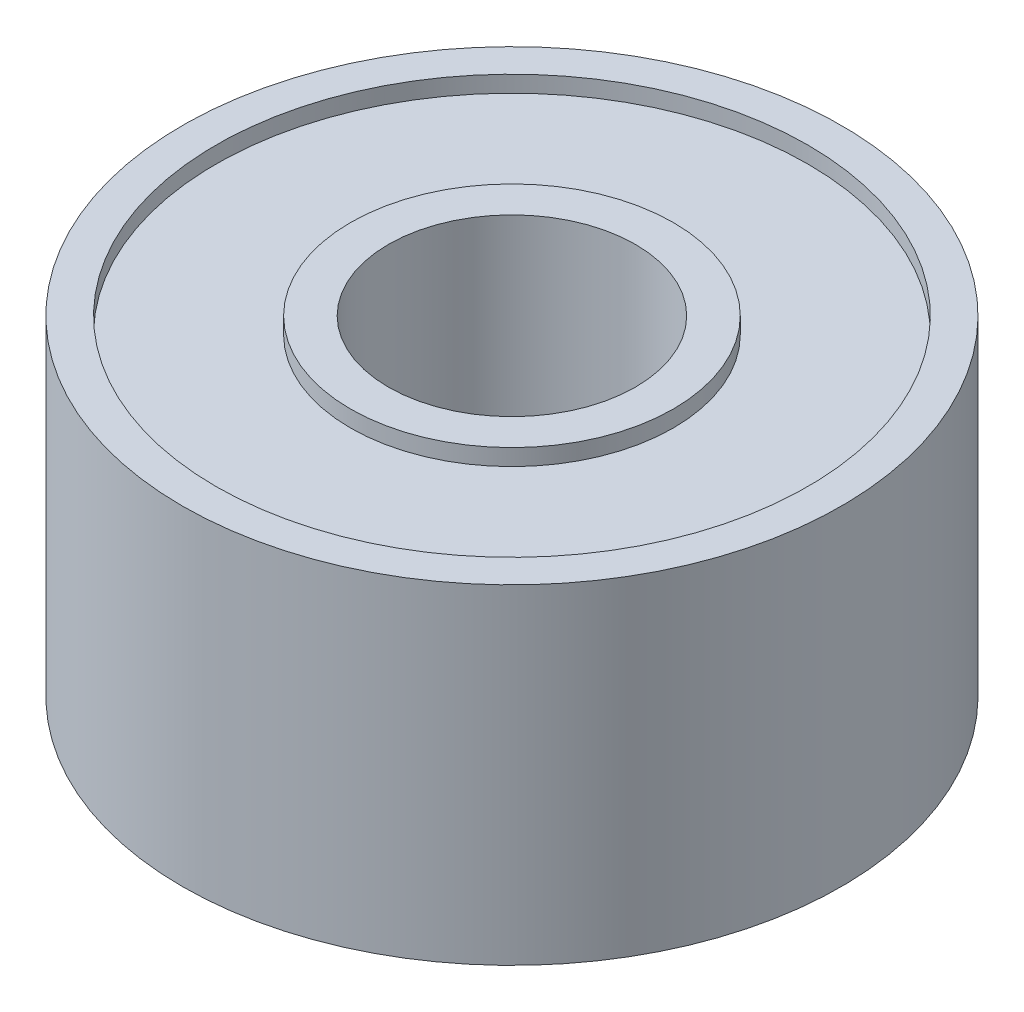
from build123d import *

# Parameters (mm, degrees)
SKETCH_1_R          = 4
SKETCH_1_R_2        = 1.5
EXTRUDE_1_DEPTH     = 4
SKETCH_2_R          = 3.590905136
SKETCH_2_R_2        = 1.959737753
CUT_EXTRUDE_1_DEPTH = 0.2
CUT_EXTRUDE_START   = -0.2
SKETCH_3_R          = 3.590905136
SKETCH_3_R_2        = 1.943393275
CUT_EXTRUDE_2_DEPTH = 0.2


with BuildPart() as part:
    # 草图1 → 凸台-拉伸1 (new body)
    with BuildSketch(Plane(origin=(0, 0, 0), x_dir=(1, 0, 0), z_dir=(0, 1, 0))):
        with Locations(Location((0, 0, 0), (0, 0, 270))):
            Circle(SKETCH_1_R)
        with Locations(Location((0, 0, 0), (0, 0, 270))):
            Circle(SKETCH_1_R_2, mode=Mode.SUBTRACT)
    extrude(amount=EXTRUDE_1_DEPTH)

    # 草图2 → 切除-拉伸1 (cut)
    with BuildSketch(Plane(origin=(0, 4, 0), x_dir=(1, 0, 0), z_dir=(0, 1, 0))):
        with Locations(Location((0, 0, 0), (0, 0, 270))):
            Circle(SKETCH_2_R)
        with Locations(Location((0, 0, 0), (0, 0, 270))):
            Circle(SKETCH_2_R_2, mode=Mode.SUBTRACT)
    extrude(amount=-CUT_EXTRUDE_1_DEPTH, mode=Mode.SUBTRACT)

    # 草图3 → 切除-拉伸2 (cut)
    with BuildSketch(Plane.XZ.offset(CUT_EXTRUDE_START)):
        with Locations(Location((0, 0, 0), (0, 0, 90))):
            Circle(SKETCH_3_R)
        with Locations(Location((0, 0, 0), (0, 0, 270))):
            Circle(SKETCH_3_R_2, mode=Mode.SUBTRACT)
    extrude(amount=CUT_EXTRUDE_2_DEPTH, mode=Mode.SUBTRACT)


solid = part.part
